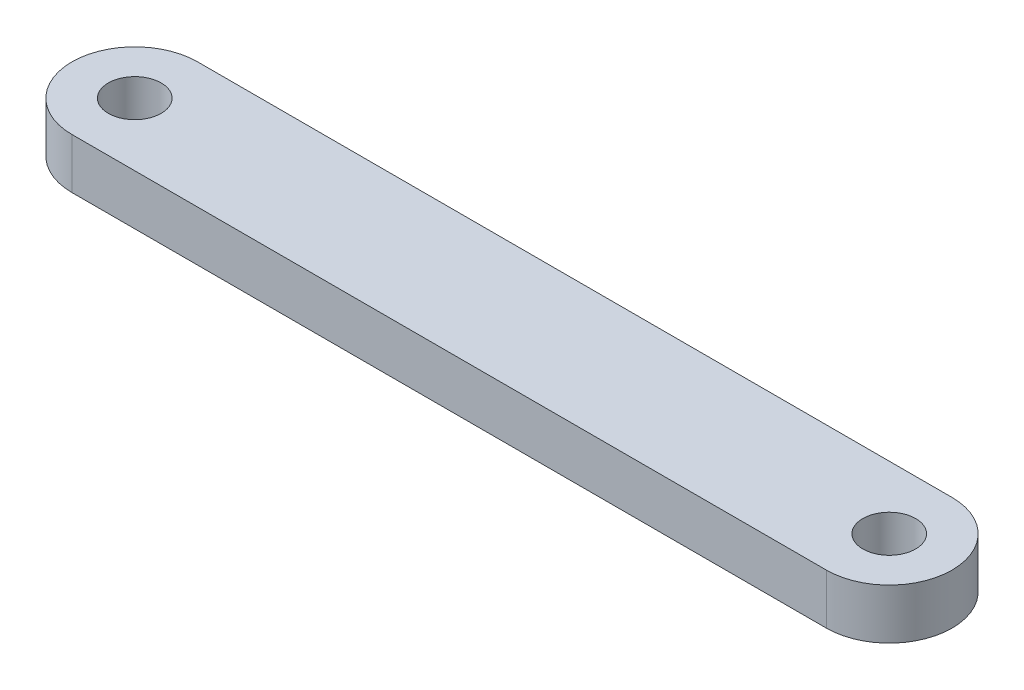
from build123d import *

# Parameters (mm, degrees)
SKETCH1_R           = 1.05
BOSS_EXTRUDE1_DEPTH = 2


with BuildPart() as part:
    # Sketch1 → Boss-Extrude1 (new body)
    with BuildSketch(Plane(origin=(0, 0, 0), x_dir=(1, 0, 0), z_dir=(0, 1, 0))):
        with BuildLine():
            Line((0, 2.5), (30, 2.5))
            ThreePointArc((30, 2.5), (32.5, 0), (30, -2.5))
            Line((30, -2.5), (0, -2.5))
            ThreePointArc((0, -2.5), (-2.5, 0), (0, 2.5))
        make_face()
        with Locations(Location((0, 0, 0), (0, 0, 270))):
            Circle(SKETCH1_R, mode=Mode.SUBTRACT)
        with Locations(Location((30, 0, 0), (0, 0, 270))):
            Circle(SKETCH1_R, mode=Mode.SUBTRACT)
    extrude(amount=BOSS_EXTRUDE1_DEPTH)


solid = part.part
